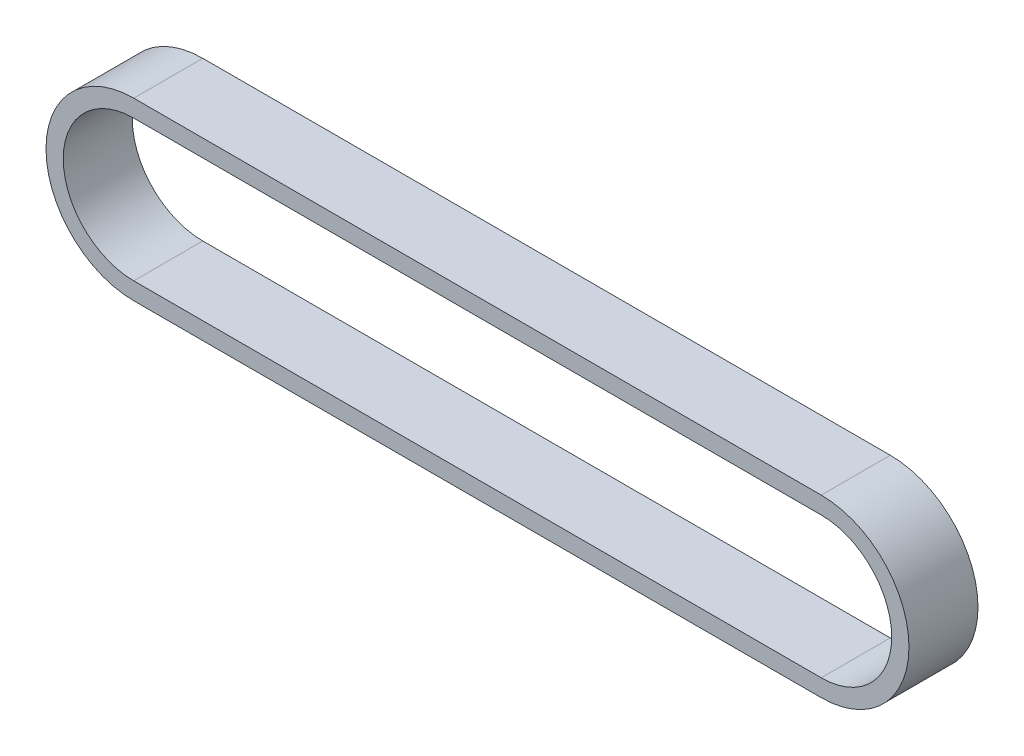
from build123d import *

# Parameters (mm, degrees)
BOSS_EXTRUDE1_DEPTH = 6


with BuildPart() as part:
    # Sketch4 → Boss-Extrude1 (new body)
    with BuildSketch(Plane.XY):
        with BuildLine():
            Line((0, 7.625), (59.75, 7.625))
            ThreePointArc((59.75, 7.625), (67.375, 0), (59.75, -7.625))
            Line((59.75, -7.625), (0, -7.625))
            ThreePointArc((0, -7.625), (-7.625, 0), (0, 7.625))
        make_face()
        with BuildLine():
            Line((0, 6.125), (59.75, 6.125))
            ThreePointArc((59.75, 6.125), (65.875, 0), (59.75, -6.125))
            Line((59.75, -6.125), (0, -6.125))
            ThreePointArc((0, -6.125), (-6.125, 0), (0, 6.125))
        make_face(mode=Mode.SUBTRACT)
    extrude(amount=BOSS_EXTRUDE1_DEPTH)


solid = part.part
